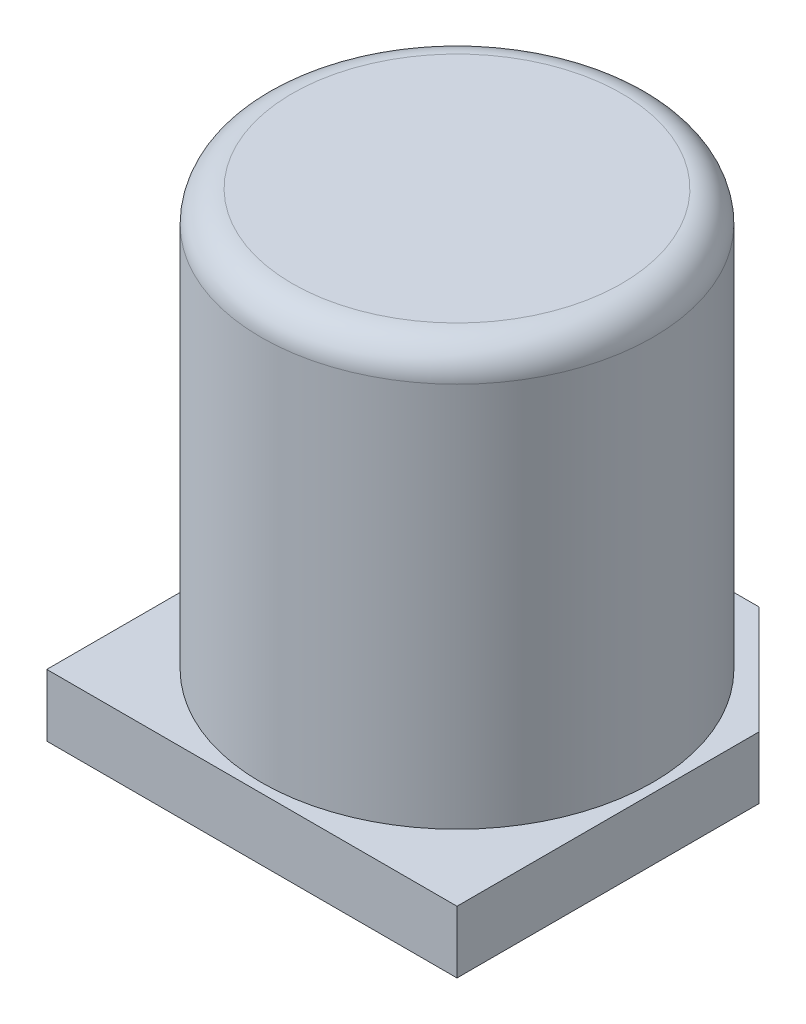
from build123d import *

# Parameters (mm, degrees)
BOSS_EXTRUDE1_DEPTH = 1
SKETCH2_R           = 3.15
BOSS_EXTRUDE2_DEPTH = 6.7
FILLET1_R           = 0.5


with BuildPart() as part:
    # Sketch1 → Boss-Extrude1 (new body)
    with BuildSketch(Plane(origin=(0, 0, 0), x_dir=(1, 0, 0), z_dir=(0, 1, 0))):
        Polygon((-1.562548269, 3.3), (-3.3, 1.562548269), (-3.3, -3.3), (3.3, -3.3), (3.3, 1.562548269), (1.562548269, 3.3), align=None)
    extrude(amount=BOSS_EXTRUDE1_DEPTH)

    # Sketch2 → Boss-Extrude2 (add)
    with BuildSketch(Plane(origin=(0, 1, 0), x_dir=(-1, 0, 0), z_dir=(0, 1, 0))):
        with Locations(Location((0, 0, 0), (0, 0, 90))):
            Circle(SKETCH2_R)
    extrude(amount=BOSS_EXTRUDE2_DEPTH)

    # Fillet1
    fillet1_edges = [part.edges().sort_by_distance(p)[0] for p in [
        (0, 7.7, -3.15),
    ]]
    fillet(fillet1_edges, radius=FILLET1_R)


solid = part.part
